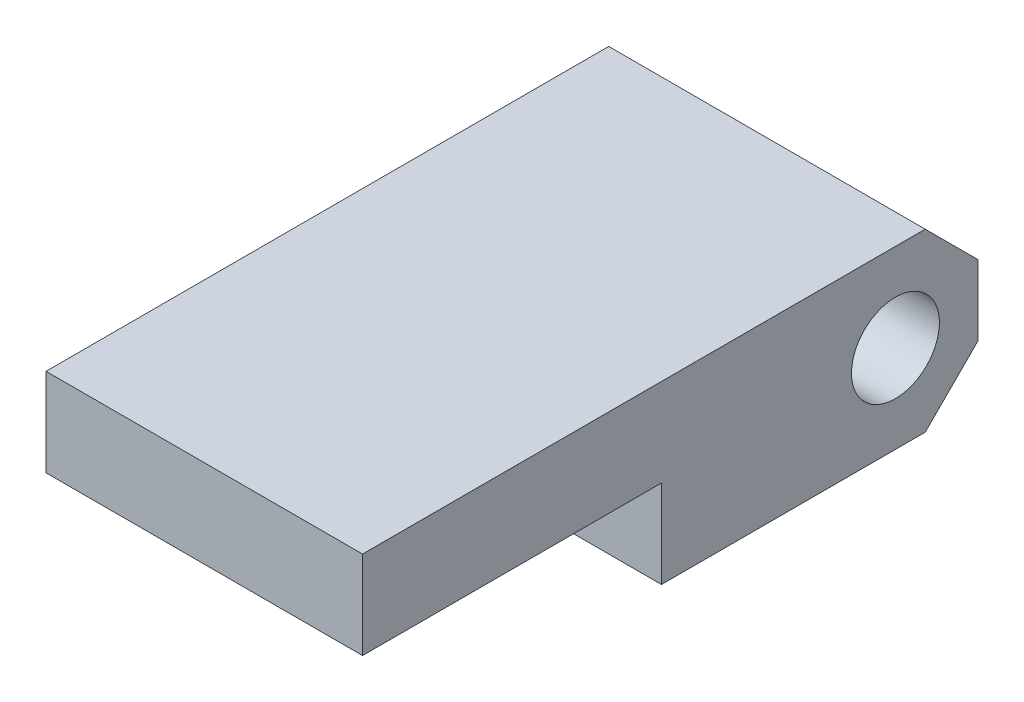
from build123d import *

# Parameters (mm, degrees)
SKETCH_1_W          = 18
SKETCH_1_H          = 35
EXTRUDE_1_DEPTH     = 10
SKETCH_2_W          = 17
SKETCH_2_H          = 5
CUT_EXTRUDE_2_DEPTH = 41.607881008
SKETCH_3_R          = 2.5
CUT_EXTRUDE_1_DEPTH = 41.607881008
CHAMFER_1_SIZE      = 3


with BuildPart() as part:
    # Эскиз1 → Вытянуть1 (new body)
    with BuildSketch(Plane(origin=(0, 0, 0), x_dir=(1, 0, 0), z_dir=(0, 1, 0))):
        with Locations((9, -17.5)):
            Rectangle(SKETCH_1_W, SKETCH_1_H)
    extrude(amount=EXTRUDE_1_DEPTH)

    # Эскиз2 → Вытянуть2 (cut, through all)
    with BuildSketch(Plane(origin=(18, 0, 0), x_dir=(0, 0, -1), z_dir=(1, 0, 0))):
        with Locations((-26.5, 2.5)):
            Rectangle(SKETCH_2_W, SKETCH_2_H)
    extrude(amount=-CUT_EXTRUDE_2_DEPTH, mode=Mode.SUBTRACT)

    # Эскиз3 → Вырез-Вытянуть1 (cut, through all)
    with BuildSketch(Plane.ZY):
        with Locations((4.695559751, 5)):
            Circle(SKETCH_3_R)
    extrude(amount=-CUT_EXTRUDE_1_DEPTH, mode=Mode.SUBTRACT)

    # Фаска1
    chamfer_1_edges = [part.edges().sort_by_distance(p)[0] for p in [
        (9, 10, 0),
        (9, 0, 0),
    ]]
    chamfer(chamfer_1_edges, length=CHAMFER_1_SIZE)


solid = part.part
